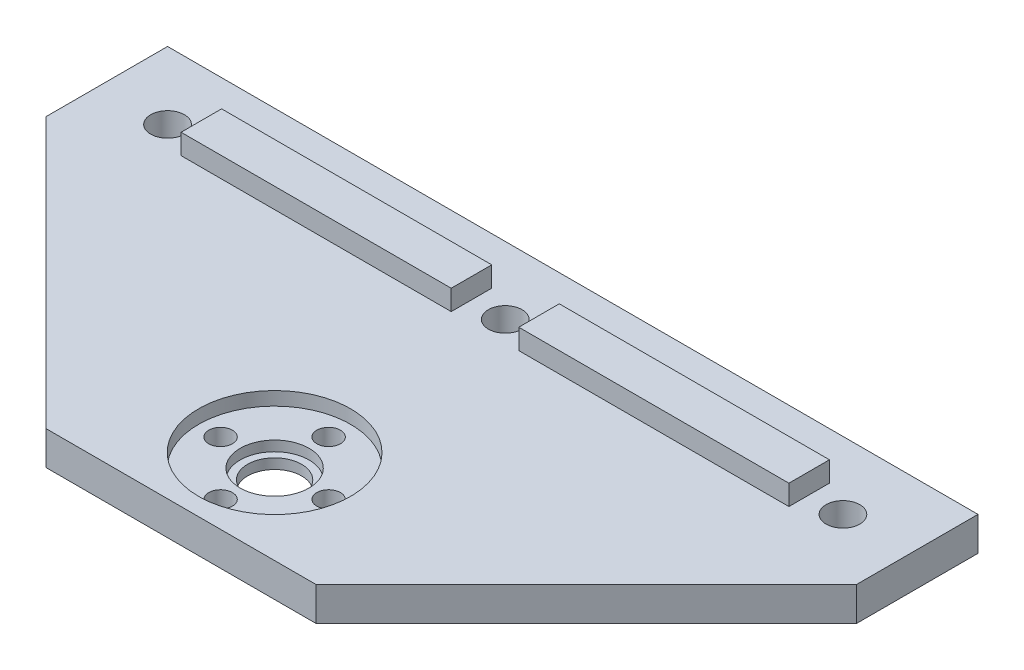
from build123d import *

# Parameters (mm, degrees)
SKETCH1_W           = 120
SKETCH1_H           = 58
BOSS_EXTRUDE5_DEPTH = 5
SKETCH5_R           = 2.5
CUT_EXTRUDE2_DEPTH  = 5
SKETCH6_W           = 40
SKETCH6_H           = 6
BOSS_EXTRUDE6_DEPTH = 3
SKETCH7_R           = 11.25
CUT_EXTRUDE3_DEPTH  = 2
SKETCH8_R           = 4
CUT_EXTRUDE4_DEPTH  = 12
SKETCH9_R           = 5.1
CUT_EXTRUDE5_DEPTH  = 1.5
SKETCH10_R          = 1.75
CUT_EXTRUDE6_DEPTH  = 21.5
CHAMFER1_SIZE       = 40


with BuildPart() as part:
    # Sketch1 → Boss-Extrude5 (new body)
    with BuildSketch(Plane(origin=(0, 0, 0), x_dir=(1, 0, 0), z_dir=(0, 1, 0))):
        with Locations((60, 29)):
            Rectangle(SKETCH1_W, SKETCH1_H)
    extrude(amount=BOSS_EXTRUDE5_DEPTH)

    # Sketch5 → Cut-Extrude2 (cut)
    with BuildSketch(Plane(origin=(0, 5, 0), x_dir=(1, 0, 0), z_dir=(0, 1, 0))):
        with Locations(Location((10, 48, 0), (0, 0, 270))):
            Circle(SKETCH5_R)
        with Locations(Location((60, 48, 0), (0, 0, 270))):
            Circle(SKETCH5_R)
        with Locations(Location((110, 48, 0), (0, 0, 270))):
            Circle(SKETCH5_R)
    extrude(amount=-CUT_EXTRUDE2_DEPTH, mode=Mode.SUBTRACT)

    # Sketch6 → Boss-Extrude6 (add)
    with BuildSketch(Plane(origin=(0, 5, 0), x_dir=(1, 0, 0), z_dir=(0, 1, 0))):
        with Locations((35, 48)):
            Rectangle(SKETCH6_W, SKETCH6_H)
        with Locations((85, 48)):
            Rectangle(SKETCH6_W, SKETCH6_H)
    extrude(amount=BOSS_EXTRUDE6_DEPTH)

    # Sketch7 → Cut-Extrude3 (cut)
    with BuildSketch(Plane(origin=(0, 5, 0), x_dir=(1, 0, 0), z_dir=(0, 1, 0))):
        with Locations(Location((60, 13.85, 0), (0, 0, 270))):
            Circle(SKETCH7_R)
    extrude(amount=-CUT_EXTRUDE3_DEPTH, mode=Mode.SUBTRACT)

    # Sketch8 → Cut-Extrude4 (cut)
    with BuildSketch(Plane(origin=(0, 3, 0), x_dir=(1, 0, 0), z_dir=(0, 1, 0))):
        with Locations(Location((60, 13.85, 0), (0, 0, 270))):
            Circle(SKETCH8_R)
    extrude(amount=-CUT_EXTRUDE4_DEPTH, mode=Mode.SUBTRACT)

    # Sketch9 → Cut-Extrude5 (cut)
    with BuildSketch(Plane(origin=(0, 3, 0), x_dir=(1, 0, 0), z_dir=(0, 1, 0))):
        with Locations(Location((60, 13.85, 0), (0, 0, 270))):
            Circle(SKETCH9_R)
    extrude(amount=-CUT_EXTRUDE5_DEPTH, mode=Mode.SUBTRACT)

    # Sketch10 → Cut-Extrude6 (cut)
    with BuildSketch(Plane(origin=(0, 3, 0), x_dir=(1, 0, 0), z_dir=(0, 1, 0))):
        with Locations(Location((52, 13.85, 0), (0, 0, 270))):
            Circle(SKETCH10_R)
        with Locations(Location((60, 21.85, 0), (0, 0, 270))):
            Circle(SKETCH10_R)
        with Locations(Location((68, 13.85, 0), (0, 0, 270))):
            Circle(SKETCH10_R)
        with Locations(Location((60, 5.85, 0), (0, 0, 270))):
            Circle(SKETCH10_R)
    extrude(amount=-CUT_EXTRUDE6_DEPTH, mode=Mode.SUBTRACT)

    # Chamfer1
    chamfer1_edges = [part.edges().sort_by_distance(p)[0] for p in [
        (120, 2.5, 0),
        (0, 2.5, 0),
    ]]
    chamfer(chamfer1_edges, length=CHAMFER1_SIZE)


solid = part.part
